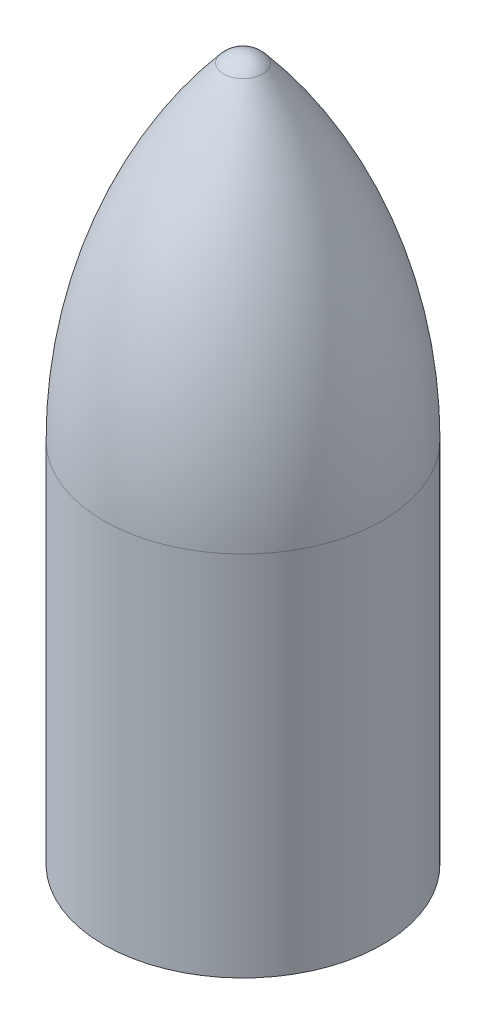
from build123d import *

# Parameters (mm, degrees)
SHELL1_T = -2.54


with BuildPart() as part:
    # Sketch1 → Revolve1 (revolve)
    with BuildSketch(Plane.XY, mode=Mode.PRIVATE) as revolve1_sk:
        with BuildLine():
            Line((-49.53, 0), (-49.53, 130.556))
            ThreePointArc((-49.53, 130.556), (-38.537049964, 192.463531829), (-6.902305408, 246.801643541))
            ThreePointArc((-6.902305408, 246.801643541), (-3.803659553, 249.161559344), (0, 250))
            Line((0, 250), (0, 0))
            Line((0, 0), (-49.53, 0))
        make_face()
    revolve(revolve1_sk.sketch.rotate(Axis((0, 255.455794576, 0), (0, -1, 0)), 270), axis=Axis((0, 255.455794576, 0), (0, -1, 0)))

    # Shell1
    shell1_openings = [part.faces().sort_by_distance(p)[0] for p in [
        (0, 0, 0),
    ]]
    offset(amount=SHELL1_T, openings=shell1_openings, kind=Kind.INTERSECTION)


solid = part.part
